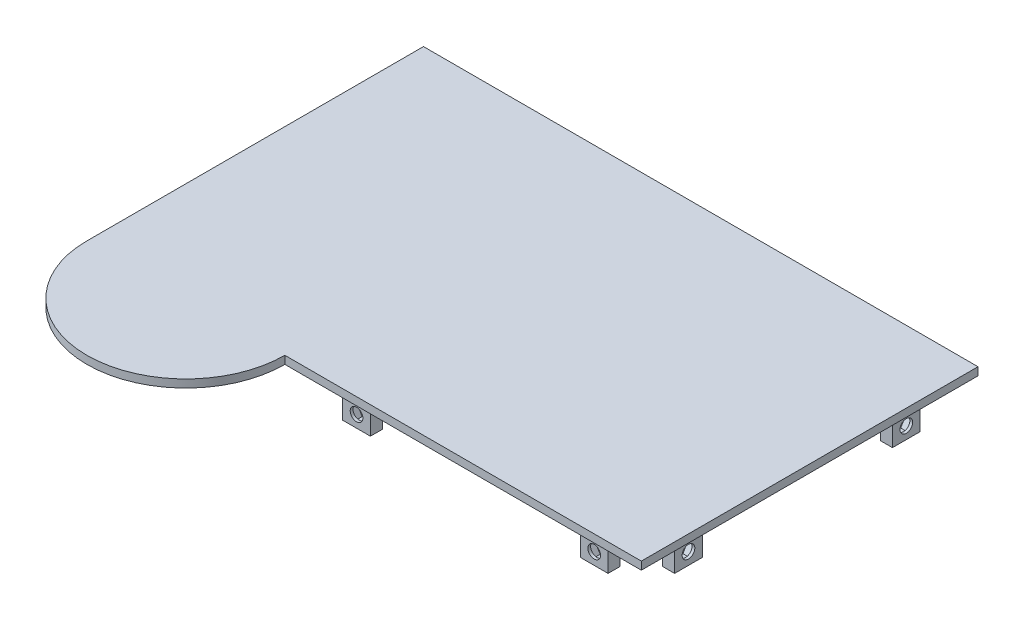
from build123d import *

# Parameters (mm, degrees)
Y_KSEKLIK_EKSTR_ZYON1_DEPTH = 2
IZIM2_W                     = 7
IZIM2_H                     = 3
IZIM2_W_2                   = 3
IZIM2_H_2                   = 7
Y_KSEKLIK_EKSTR_ZYON2_DEPTH = 8
KES_EKSTR_ZYON1_DEPTH       = 2.3
KES_EKSTR_ZYON2_DEPTH       = 2.3
KES_EKSTR_ZYON3_DEPTH       = 2.3
KES_EKSTR_ZYON4_DEPTH       = 2.3
KES_EKSTR_ZYON5_DEPTH       = 2.3
KES_EKSTR_ZYON7_DEPTH       = 2.3
KES_EKSTR_ZYON9_DEPTH       = 2.3
KES_EKSTR_ZYON10_DEPTH      = 2.3
IZIM15_R                    = 1.6
KES_EKSTR_ZYON11_DEPTH      = 5
IZIM16_R                    = 1.6
KES_EKSTR_ZYON12_DEPTH      = 5
IZIM17_R                    = 1.6
KES_EKSTR_ZYON13_DEPTH      = 5
IZIM18_R                    = 1.6
KES_EKSTR_ZYON14_DEPTH      = 5
IZIM19_R                    = 1.6
KES_EKSTR_ZYON15_DEPTH      = 5
KES_EKSTR_ZYON16_START      = -5
IZIM20_R                    = 1.6
KES_EKSTR_ZYON16_DEPTH      = 5
KES_EKSTR_ZYON17_START      = -5
IZIM21_R                    = 1.6
KES_EKSTR_ZYON17_DEPTH      = 5
KES_EKSTR_ZYON18_START      = -5
IZIM22_R                    = 1.6
KES_EKSTR_ZYON18_DEPTH      = 5


with BuildPart() as part:
    # Çizim1 → Yükseklik-Ekstrüzyon1 (new body)
    with BuildSketch(Plane(origin=(0, 0, 0), x_dir=(1, 0, 0), z_dir=(0, 1, 0))):
        with BuildLine():
            Line((50, 0), (140, 0))
            Line((140, 0), (140, 85))
            Line((140, 85), (0, 85))
            Line((0, 85), (0, 0))
            ThreePointArc((0, 0), (25, -25), (50, 0))
        make_face()
    extrude(amount=Y_KSEKLIK_EKSTR_ZYON1_DEPTH)

    # Çizim2 → Yükseklik-Ekstrüzyon2 (add)
    with BuildSketch(Plane.XZ):
        with Locations((15, -80.4)):
            Rectangle(IZIM2_W, IZIM2_H)
        with Locations((125, -80.4)):
            Rectangle(IZIM2_W, IZIM2_H)
        with Locations((4.6, -70)):
            Rectangle(IZIM2_W_2, IZIM2_H_2)
        with Locations((4.6, -15)):
            Rectangle(IZIM2_W_2, IZIM2_H_2)
        with Locations((135.4, -70)):
            Rectangle(IZIM2_W_2, IZIM2_H_2)
        with Locations((135.4, -15)):
            Rectangle(IZIM2_W_2, IZIM2_H_2)
        with Locations((125, -4.6)):
            Rectangle(IZIM2_W, IZIM2_H)
        with Locations((65, -4.6)):
            Rectangle(IZIM2_W, IZIM2_H)
    extrude(amount=Y_KSEKLIK_EKSTR_ZYON2_DEPTH)

    # Çizim3 → Kes-Ekstrüzyon1 (cut)
    with BuildSketch(Plane(origin=(0, 0, -6.1), x_dir=(-1, 0, 0), z_dir=(0, 0, -1))):
        Polygon((-68.175426481, -5), (-66.58771324, -7.75), (-63.41228676, -7.75), (-61.824573519, -5), (-63.41228676, -2.25), (-66.58771324, -2.25), align=None)
    extrude(amount=-KES_EKSTR_ZYON1_DEPTH, mode=Mode.SUBTRACT)

    # Çizim4 → Kes-Ekstrüzyon2 (cut)
    with BuildSketch(Plane(origin=(0, 0, -6.1), x_dir=(-1, 0, 0), z_dir=(0, 0, -1))):
        Polygon((-126.484912109, -2.193156691), (-128.173253665, -4.882549954), (-126.688341556, -7.689393263), (-123.515087891, -7.806843309), (-121.826746335, -5.117450046), (-123.311658444, -2.310606737), align=None)
    extrude(amount=-KES_EKSTR_ZYON2_DEPTH, mode=Mode.SUBTRACT)

    # Çizim5 → Kes-Ekstrüzyon3 (cut)
    with BuildSketch(Plane(origin=(6.1, 0, 0), x_dir=(0, 0, -1), z_dir=(1, 0, 0))):
        Polygon((13.457838364, -2.224199067), (11.825005058, -4.947650687), (13.367166694, -7.72345162), (16.542161636, -7.775800933), (18.174994942, -5.052349313), (16.632833306, -2.27654838), align=None)
    extrude(amount=-KES_EKSTR_ZYON3_DEPTH, mode=Mode.SUBTRACT)

    # Çizim6 → Kes-Ekstrüzyon4 (cut)
    with BuildSketch(Plane(origin=(6.1, 0, 0), x_dir=(0, 0, -1), z_dir=(1, 0, 0))):
        Polygon((68.416764228, -2.247419788), (66.824577724, -4.994832293), (68.407813496, -7.747412505), (71.583235772, -7.752580212), (73.175422276, -5.005167707), (71.592186504, -2.252587495), align=None)
    extrude(amount=-KES_EKSTR_ZYON4_DEPTH, mode=Mode.SUBTRACT)

    # Çizim7 → Kes-Ekstrüzyon5 (cut)
    with BuildSketch(Plane.XY.offset(-78.9)):
        Polygon((13.418242397, -2.246570099), (11.824580957, -4.993127316), (13.40633856, -7.746557217), (16.581757603, -7.753429901), (18.175419043, -5.006872684), (16.59366144, -2.253442783), align=None)
    extrude(amount=-KES_EKSTR_ZYON5_DEPTH, mode=Mode.SUBTRACT)

    # Çizim9 → Kes-Ekstrüzyon7 (cut)
    with BuildSketch(Plane.ZY.offset(-133.9)):
        Polygon((-16.559885261, -2.234120157), (-18.175264838, -4.967960341), (-16.615379578, -7.733840184), (-13.440114739, -7.765879843), (-11.824735162, -5.032039659), (-13.384620422, -2.266159816), align=None)
    extrude(amount=-KES_EKSTR_ZYON7_DEPTH, mode=Mode.SUBTRACT)

    # Çizim11 → Kes-Ekstrüzyon9 (cut)
    with BuildSketch(Plane.ZY.offset(-133.9)):
        Polygon((-71.58771324, -2.25), (-73.175426481, -5), (-71.58771324, -7.75), (-68.41228676, -7.75), (-66.824573519, -5), (-68.41228676, -2.25), align=None)
    extrude(amount=-KES_EKSTR_ZYON9_DEPTH, mode=Mode.SUBTRACT)

    # Çizim12 → Kes-Ekstrüzyon10 (cut)
    with BuildSketch(Plane.XY.offset(-78.9)):
        Polygon((123.41228676, -2.25), (121.824573519, -5), (123.41228676, -7.75), (126.58771324, -7.75), (128.175426481, -5), (126.58771324, -2.25), align=None)
    extrude(amount=-KES_EKSTR_ZYON10_DEPTH, mode=Mode.SUBTRACT)

    # Çizim15 → Kes-Ekstrüzyon11 (cut)
    with BuildSketch(Plane.XY.offset(-3.1)):
        with Locations((125, -5)):
            Circle(IZIM15_R)
    extrude(amount=-KES_EKSTR_ZYON11_DEPTH, mode=Mode.SUBTRACT)

    # Çizim16 → Kes-Ekstrüzyon12 (cut)
    with BuildSketch(Plane.XY.offset(-3.1)):
        with Locations((65, -5)):
            Circle(IZIM16_R)
    extrude(amount=-KES_EKSTR_ZYON12_DEPTH, mode=Mode.SUBTRACT)

    # Çizim17 → Kes-Ekstrüzyon13 (cut)
    with BuildSketch(Plane.ZY.offset(-3.1)):
        with Locations((-15, -5)):
            Circle(IZIM17_R)
    extrude(amount=-KES_EKSTR_ZYON13_DEPTH, mode=Mode.SUBTRACT)

    # Çizim18 → Kes-Ekstrüzyon14 (cut)
    with BuildSketch(Plane.ZY.offset(-3.1)):
        with Locations((-70, -5)):
            Circle(IZIM18_R)
    extrude(amount=-KES_EKSTR_ZYON14_DEPTH, mode=Mode.SUBTRACT)

    # Çizim19 → Kes-Ekstrüzyon15 (cut)
    with BuildSketch(Plane(origin=(0, 0, -81.9), x_dir=(-1, 0, 0), z_dir=(0, 0, -1))):
        with Locations((-15, -5)):
            Circle(IZIM19_R)
    extrude(amount=-KES_EKSTR_ZYON15_DEPTH, mode=Mode.SUBTRACT)

    # Çizim20 → Kes-Ekstrüzyon16 (cut)
    with BuildSketch(Plane(origin=(0, 0, -81.9), x_dir=(-1, 0, 0), z_dir=(0, 0, -1)).offset(KES_EKSTR_ZYON16_START)):
        with Locations(Location((-125, -5, 0), (0, 0, 180))):
            Circle(IZIM20_R)
    extrude(amount=KES_EKSTR_ZYON16_DEPTH, mode=Mode.SUBTRACT)

    # Çizim21 → Kes-Ekstrüzyon17 (cut)
    with BuildSketch(Plane(origin=(136.9, 0, 0), x_dir=(0, 0, -1), z_dir=(1, 0, 0)).offset(KES_EKSTR_ZYON17_START)):
        with Locations(Location((70, -5, 0), (0, 0, 180))):
            Circle(IZIM21_R)
    extrude(amount=KES_EKSTR_ZYON17_DEPTH, mode=Mode.SUBTRACT)

    # Çizim22 → Kes-Ekstrüzyon18 (cut)
    with BuildSketch(Plane(origin=(136.9, 0, 0), x_dir=(0, 0, -1), z_dir=(1, 0, 0)).offset(KES_EKSTR_ZYON18_START)):
        with Locations(Location((15, -5, 0), (0, 0, 180))):
            Circle(IZIM22_R)
    extrude(amount=KES_EKSTR_ZYON18_DEPTH, mode=Mode.SUBTRACT)


solid = part.part
